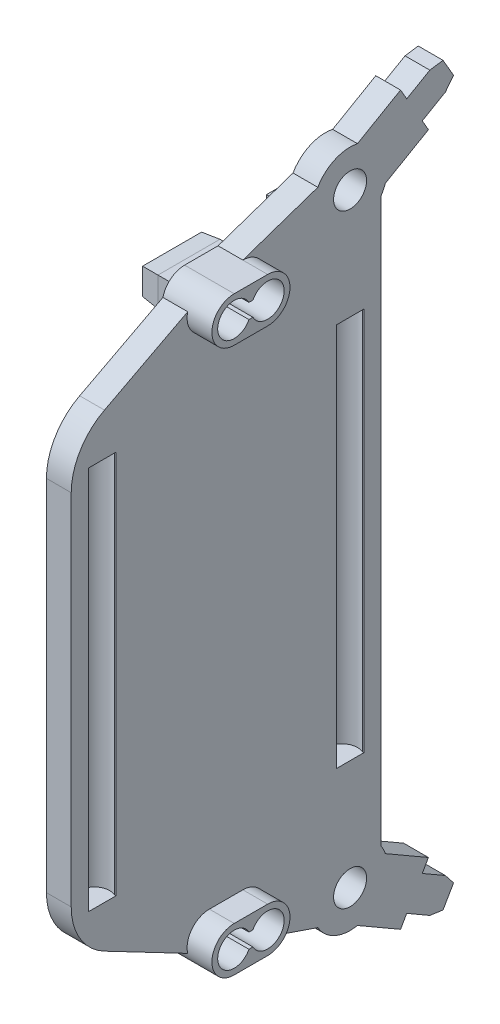
from build123d import *

# Parameters (mm, degrees)
SKETCH3_R                   = 3.81
DOWELSUPPORT_DEPTH          = 1.27
SKETCH5_W                   = 6.35
SKETCH5_H                   = 44.45
SLIDERDOWELSUPPORT_DEPTH    = 1.27
SKETCH17_R                  = 1.549999948
CUT_EXTRUDE1_DEPTH          = 19.685
CUT_EXTRUDE2_DEPTH          = 36.066505943
CUT_EXTRUDE2_DEPTH_BACK     = 36.066505943
SKETCH18_W                  = 1.27
SKETCH18_H                  = 25.4
LPATTERN1_COUNT             = 2
LPATTERN1_PITCH             = 25.4
LATERALSUPPORT_DEPTH        = 1.27
SKETCH8_W                   = 6.35
SKETCH8_H                   = 3
TABSUPPORT_DEPTH            = 1.27
STRINGDOWELSUPPORT_START    = -1.27
STRINGDOWELSUPPORT_DEPTH    = 5.08
INTERSUPPORT_DEPTH          = 1.27
SKETCH10_W                  = 6.35
SKETCH10_H                  = 3
TABBASE_DEPTH               = 1.27
SKETCH12_W                  = 6.35
SKETCH12_H                  = 3
TABDRAFT_DEPTH              = 1.73
TABDRAFT_DRAFT              = 5
TABDRAFT_PROFILE_2_DEPTH    = 1.73
TABDRAFT_PROFILE_2_DRAFT    = 5
STRINGDOWELHOLES_DEPTH      = 48.629791179
STRINGDOWELHOLES_DEPTH_BACK = 1.524
SKETCH14_R                  = 1.690500048
PULLEYDOWELHOLE_DEPTH       = 2.54
FILLET1_R                   = 6.35


with BuildPart() as part:
    # Sketch3 → DowelSupport (new, symmetric)
    with BuildSketch(Plane(origin=(0, 0, 0), x_dir=(0, 0, -1), z_dir=(1, 0, 0))):
        with Locations((0, 30.95625)):
            Circle(SKETCH3_R)
    extrude(amount=DOWELSUPPORT_DEPTH, both=True)

    # Sketch8 → TabSupport (add, symmetric)
    with BuildSketch(Plane(origin=(0, 0, 0), x_dir=(0, 0, -1), z_dir=(1, 0, 0))):
        with Locations((0, 27.94)):
            Rectangle(SKETCH8_W, SKETCH8_H)
        with Locations((-12.7, 27.94)):
            Rectangle(SKETCH8_W, SKETCH8_H)
    extrude(amount=TABSUPPORT_DEPTH, both=True)


with BuildPart() as body_2:
    # Sketch5 → SliderDowelSupport (new, symmetric)
    with BuildSketch(Plane(origin=(0, 0, 0), x_dir=(0, 0, -1), z_dir=(1, 0, 0))):
        Rectangle(SKETCH5_W, SKETCH5_H)
    extrude(amount=SLIDERDOWELSUPPORT_DEPTH, both=True)

    # Sketch17 → Cut-Extrude1 (cut, symmetric)
    with BuildSketch(Plane(origin=(0, 0, 0), x_dir=(1, 0, 0), z_dir=(0, 1, 0))):
        with Locations((0.482000052, 0)):
            Circle(SKETCH17_R)
        with BuildLine():
            Line((2.032, 0), (2.032, 1.399999994))
            Line((2.032, 1.399999994), (1.147206678, 1.399999994))
            ThreePointArc((1.147206678, 1.399999994), (1.792261491, 0.828078983), (2.032, 0))
        make_face()
        with BuildLine():
            Line((2.032, -1.399999994), (2.032, 0))
            ThreePointArc((2.032, 0), (1.792261491, -0.828078983), (1.147206678, -1.399999994))
            Line((1.147206678, -1.399999994), (2.032, -1.399999994))
        make_face()
    extrude(amount=CUT_EXTRUDE1_DEPTH, both=True, mode=Mode.SUBTRACT)

    # Sketch18 → Cut-Extrude2 (cut, two sides: drawn at the far end of the back side and taken through both)
    with BuildSketch(Plane.ZY.offset(1.27).offset(-CUT_EXTRUDE2_DEPTH_BACK)):
        Rectangle(SKETCH18_W, SKETCH18_H)
    extrude(amount=CUT_EXTRUDE2_DEPTH + CUT_EXTRUDE2_DEPTH_BACK, mode=Mode.SUBTRACT)


with BuildPart() as lpattern1_1:
    # LPattern1: pattern copy
    add(body_2.part.moved(Location(Vector(0, 0, 1) * (1 * LPATTERN1_PITCH))))


with BuildPart() as body_4:
    # Sketch6 → LateralSupport (new, symmetric)
    with BuildSketch(Plane(origin=(0, 0, 0), x_dir=(0, 0, -1), z_dir=(1, 0, 0))):
        Polygon((7.392863577, 33.391434671), (5.805363577, 36.141065329), (8.169612929, 37.506065329), (9.523465192, 37.701124423), (10.602965192, 35.831375577), (9.757112929, 34.756434671), align=None)
    extrude(amount=LATERALSUPPORT_DEPTH, both=True)


with BuildPart() as tabsupport_piece_1:
    # of the separate pieces the step leaves, piece 1, a body of its own (tabsupport_pieces)
    add(part.part.solids().sort_by_distance((1.27, 28.850193258, 3.175))[0])


with BuildPart() as tabsupport_piece_2:
    # of the separate pieces the step leaves, piece 2, a body of its own (tabsupport_pieces)
    add(part.part.solids().sort_by_distance((-1.27, 26.44, 9.525))[0])

    # Sketch15 → StringDowelSupport (add)
    with BuildSketch(Plane(origin=(0, 0, 0), x_dir=(0, 0, -1), z_dir=(1, 0, 0)).offset(STRINGDOWELSUPPORT_START)):
        with BuildLine():
            Line((-14.4145, 30.226), (-10.9855, 30.226))
            ThreePointArc((-10.9855, 30.226), (-8.6995, 27.94), (-10.9855, 25.654))
            Line((-10.9855, 25.654), (-14.4145, 25.654))
            ThreePointArc((-14.4145, 25.654), (-16.7005, 27.94), (-14.4145, 30.226))
        make_face()
    extrude(amount=STRINGDOWELSUPPORT_DEPTH)


with BuildPart() as body_2_1:
    add(body_2.part)

    add(lpattern1_1.part)  # InterSupport merges LPattern1_1

    add(body_4.part)  # InterSupport merges body 4

    add(tabsupport_piece_1.part)  # InterSupport merges TabSupport piece 1

    add(tabsupport_piece_2.part)  # InterSupport merges TabSupport piece 2
    # Sketch7 → InterSupport (add, symmetric)
    with BuildSketch(Plane(origin=(0, 0, 0), x_dir=(0, 0, -1), z_dir=(1, 0, 0))):
        Polygon((5.170363577, 37.240917591), (8.027863577, 32.291582409), (1.42875, 28.481582409), (-1.42875, 33.430917591), align=None)
        Polygon((-3.175, 15.875), (-3.175, 22.225), (3.175, 22.225), (3.175, 26.44), (0.923046602, 28.251940251), (-0.923046602, 33.660559749), (-10.9855, 30.226), (-14.4145, 30.226), (-15.109807039, 29.269115541), (-28.575, 22.225), (-22.225, 22.225), (-22.225, 0), (-3.175, 0), align=None)
    extrude(amount=INTERSUPPORT_DEPTH, both=True)

    # Sketch10 → TabBase (add)
    with BuildSketch(Plane.ZY.offset(1.27)):
        with Locations((0, 27.94)):
            Rectangle(SKETCH10_W, SKETCH10_H)
        with Locations((12.7, 27.94)):
            Rectangle(SKETCH10_W, SKETCH10_H)
    extrude(amount=TABBASE_DEPTH)


with BuildPart() as tabdraft_tool:
    # Sketch12 → TabDraft (with draft: the straight prism first)
    with BuildSketch(Plane.ZY.offset(2.54)):
        with Locations((0, 27.94)):
            Rectangle(SKETCH12_W, SKETCH12_H)
    extrude(amount=TABDRAFT_DEPTH)
    # TabDraft: the draft: its side faces are tilted about the plane it starts from
    tabdraft_sides = [tabdraft_tool.faces().sort_by_distance(p)[0] for p in [
        (-3.405, 27.94, 3.175),
        (-3.405, 29.44, 0),
        (-3.405, 27.94, -3.175),
        (-3.405, 26.44, 0),
    ]]
    draft(tabdraft_sides, Plane.ZY.offset(2.54), TABDRAFT_DRAFT)


with BuildPart() as body_2_2:
    add(body_2_1.part)

    # TabDraft: add tabdraft_tool
    add(tabdraft_tool.part)


with BuildPart() as tabdraft_profile_2_tool:
    # Sketch12 → TabDraft profile 2 (with draft: the straight prism first)
    with BuildSketch(Plane.ZY.offset(2.54)):
        with Locations((12.7, 27.94)):
            Rectangle(SKETCH12_W, SKETCH12_H)
    extrude(amount=TABDRAFT_PROFILE_2_DEPTH)
    # TabDraft profile 2: the draft: its side faces are tilted about the plane it starts from
    tabdraft_profile_2_sides = [tabdraft_profile_2_tool.faces().sort_by_distance(p)[0] for p in [
        (-3.405, 27.94, 9.525),
        (-3.405, 26.44, 12.7),
        (-3.405, 27.94, 15.875),
        (-3.405, 29.44, 12.7),
    ]]
    draft(tabdraft_profile_2_sides, Plane.ZY.offset(2.54), TABDRAFT_PROFILE_2_DRAFT)


with BuildPart() as body_2_3:
    add(body_2_2.part)

    # TabDraft profile 2: add tabdraft_profile_2_tool
    add(tabdraft_profile_2_tool.part)

    # Sketch16 → StringDowelHoles (cut, two sides: drawn at the far end of the back side and taken through both)
    with BuildSketch(Plane(origin=(1.27, 0, 0), x_dir=(0, 0, -1), z_dir=(1, 0, 0)).offset(-STRINGDOWELHOLES_DEPTH_BACK)):
        with BuildLine():
            Line((-12.905478326, 27.178), (-12.494521674, 27.178))
            ThreePointArc((-12.494521674, 27.178), (-9.294999952, 27.94), (-12.494521674, 28.702))
            Line((-12.494521674, 28.702), (-12.905478326, 28.702))
            ThreePointArc((-12.905478326, 28.702), (-16.105000048, 27.94), (-12.905478326, 27.178))
        make_face()
    extrude(amount=STRINGDOWELHOLES_DEPTH + STRINGDOWELHOLES_DEPTH_BACK, mode=Mode.SUBTRACT)

    # Sketch14 → PulleyDowelHole (cut)
    with BuildSketch(Plane(origin=(1.27, 0, 0), x_dir=(0, 0, -1), z_dir=(1, 0, 0))):
        with Locations((0, 30.95625)):
            Circle(SKETCH14_R)
    extrude(amount=-PULLEYDOWELHOLE_DEPTH, mode=Mode.SUBTRACT)

    # Mirror1: body 2 across plane


with BuildPart() as body_2_4:
    add(body_2_3.part)
    add(body_2_3.part.mirror(Plane.ZX))

    # Fillet1
    fillet1_edges = [body_2_4.edges().sort_by_distance(p)[0] for p in [
        (0, -22.225, 28.575),
        (0, 22.225, 28.575),
    ]]
    fillet(fillet1_edges, radius=FILLET1_R)


solid = body_2_4.part
